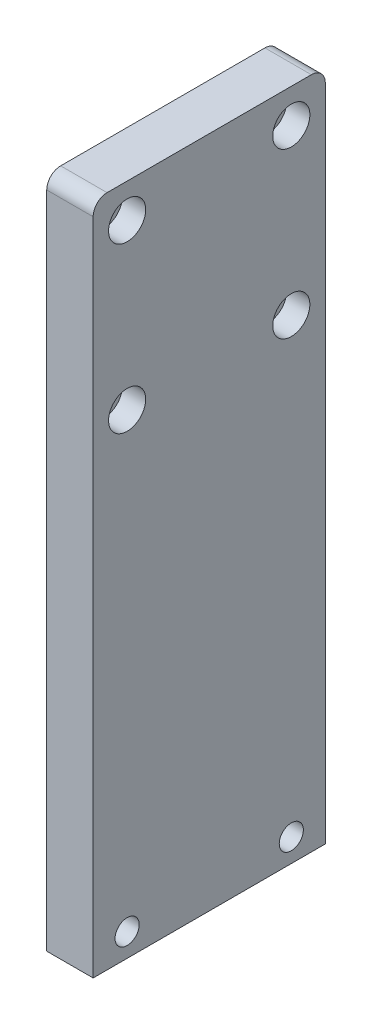
from build123d import *

# Parameters (mm, degrees)
CROQUIS1_R              = 2.6
SALIENTE_EXTRUIR1_DEPTH = 10
CROQUIS5_R              = 4
CORTAR_EXTRUIR2_DEPTH   = 5
FILLET1_R               = 3
SKETCH1_R               = 4
CUT_EXTRUDE1_DEPTH      = 5


with BuildPart() as part:
    # Croquis1 → Saliente-Extruir1 (new body)
    with BuildSketch(Plane(origin=(0, 0, 0), x_dir=(0, 0, -1), z_dir=(1, 0, 0))):
        Polygon((-25, -120), (25, -120), (25, 25), (0, 25), (-25, 25), (-25, 0), align=None)
        with Locations((-17.68, 17.68)):
            Circle(CROQUIS1_R, mode=Mode.SUBTRACT)
        with Locations(Location((17.68, 17.68, 0), (0, 0, 180))):
            Circle(CROQUIS1_R, mode=Mode.SUBTRACT)
        with Locations((17.68, -17.68)):
            Circle(CROQUIS1_R, mode=Mode.SUBTRACT)
        with Locations(Location((-17.68, -17.68, 0), (0, 0, 180))):
            Circle(CROQUIS1_R, mode=Mode.SUBTRACT)
        with Locations((-17.68, -115)):
            Circle(CROQUIS1_R, mode=Mode.SUBTRACT)
        with Locations(Location((17.68, -115, 0), (0, 0, 180))):
            Circle(CROQUIS1_R, mode=Mode.SUBTRACT)
    extrude(amount=SALIENTE_EXTRUIR1_DEPTH)

    # Croquis5 → Cortar-Extruir2 (cut)
    with BuildSketch(Plane(origin=(10, 0, 0), x_dir=(0, 0, -1), z_dir=(1, 0, 0))):
        with Locations((17.68, 17.68)):
            Circle(CROQUIS5_R)
        with Locations((-17.68, 17.68)):
            Circle(CROQUIS5_R)
        with Locations((-17.68, -17.68)):
            Circle(CROQUIS5_R)
        with Locations((17.68, -17.68)):
            Circle(CROQUIS5_R)
    extrude(amount=-CORTAR_EXTRUIR2_DEPTH, mode=Mode.SUBTRACT)

    # Fillet1
    fillet1_edges = [part.edges().sort_by_distance(p)[0] for p in [
        (5, 25, -25),
        (5, 25, 25),
    ]]
    fillet(fillet1_edges, radius=FILLET1_R)

    # Sketch1 → Cut-Extrude1 (cut)
    with BuildSketch(Plane.ZY):
        with Locations((17.68, -115)):
            Circle(SKETCH1_R)
        with Locations(Location((-17.68, -115, 0), (0, 0, 180))):
            Circle(SKETCH1_R)
    extrude(amount=-CUT_EXTRUDE1_DEPTH, mode=Mode.SUBTRACT)


solid = part.part
